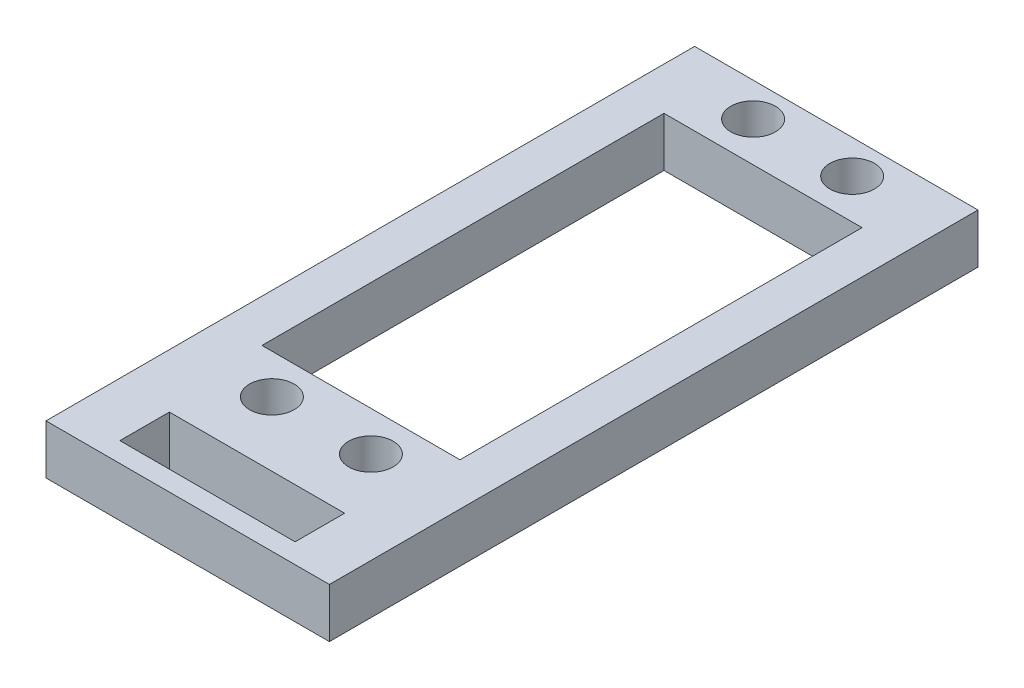
from build123d import *

# Parameters (mm, degrees)
SKETCH1_R           = 2.25
SKETCH1_W           = 20
SKETCH1_H           = 40.6
SKETCH1_W_2         = 17.696235852
SKETCH1_H_2         = 5
BOSS_EXTRUDE1_DEPTH = 5


with BuildPart() as part:
    # Sketch1 → Boss-Extrude1 (new body)
    with BuildSketch(Plane(origin=(0, 0, 0), x_dir=(1, 0, 0), z_dir=(0, 1, 0))):
        Polygon((-4.308878206, -48), (-4.308878206, 7.4), (24.308878206, 7.4), (24.308878206, -48), (24.308878206, -58.1), (-4.308878206, -58.1), align=None)
        with Locations(Location((5, 4, 0), (0, 0, 270))):
            Circle(SKETCH1_R, mode=Mode.SUBTRACT)
        with Locations(Location((15, 4, 0), (0, 0, 90))):
            Circle(SKETCH1_R, mode=Mode.SUBTRACT)
        with Locations(Location((5, -44.6, 0), (0, 0, 90))):
            Circle(SKETCH1_R, mode=Mode.SUBTRACT)
        with Locations(Location((15, -44.6, 0), (0, 0, 270))):
            Circle(SKETCH1_R, mode=Mode.SUBTRACT)
        with Locations((10, -20.3)):
            Rectangle(SKETCH1_W, SKETCH1_H, mode=Mode.SUBTRACT)
        with Locations((10, -53.6)):
            Rectangle(SKETCH1_W_2, SKETCH1_H_2, mode=Mode.SUBTRACT)
    extrude(amount=BOSS_EXTRUDE1_DEPTH)


solid = part.part
